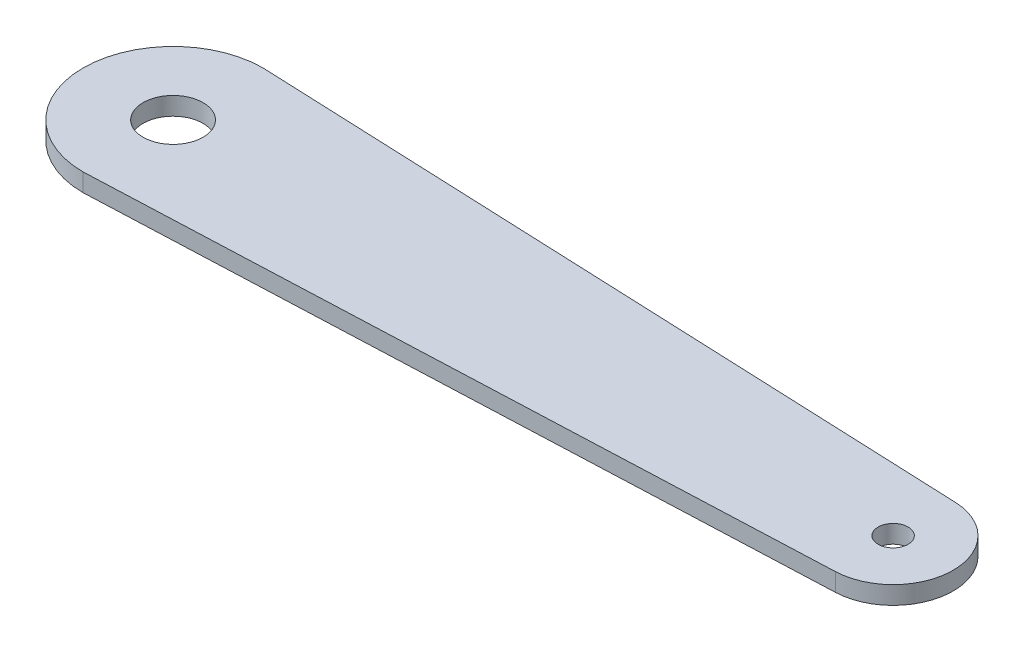
from build123d import *

# Parameters (mm, degrees)
SKETCH_1_R          = 5
EXTRUDE_1_DEPTH     = 3
SKETCH_2_R          = 2.5
CUT_EXTRUDE_1_DEPTH = 131.896905999


with BuildPart() as part:
    # 草图1 → 凸台-拉伸1 (new body)
    with BuildSketch(Plane(origin=(0, 0, 0), x_dir=(1, 0, 0), z_dir=(0, 1, 0))):
        with BuildLine():
            Line((0, -15), (120.415586748, -9.991360651))
            ThreePointArc((120.415586748, -9.991360651), (130, 0), (120.415586748, 9.991360651))
            Line((120.415586748, 9.991360651), (0, 15))
            ThreePointArc((0, 15), (-15, 0), (0, -15))
        make_face()
        with Locations(Location((0, 0, 0), (0, 0, 270))):
            Circle(SKETCH_1_R, mode=Mode.SUBTRACT)
    extrude(amount=EXTRUDE_1_DEPTH)

    # 草图2 → 切除-拉伸1 (cut, through all)
    with BuildSketch(Plane(origin=(0, 3, 0), x_dir=(1, 0, 0), z_dir=(0, 1, 0))):
        with Locations(Location((120, 0, 0), (0, 0, 270))):
            Circle(SKETCH_2_R)
    extrude(amount=-CUT_EXTRUDE_1_DEPTH, mode=Mode.SUBTRACT)


solid = part.part
